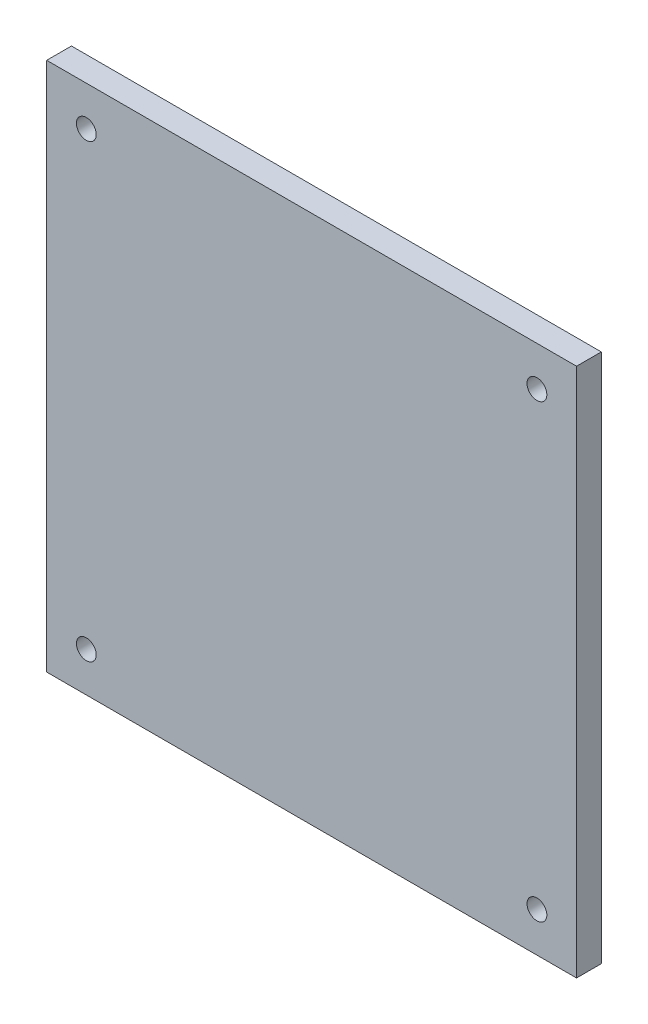
from build123d import *

# Parameters (mm, degrees)
SKETCH1_W           = 107
SKETCH1_H           = 107
BOSS_EXTRUDE1_DEPTH = 5
SKETCH2_R           = 2
CUT_EXTRUDE1_DEPTH  = 5


with BuildPart() as part:
    # Sketch1 → Boss-Extrude1 (new body)
    with BuildSketch(Plane.XY):
        Rectangle(SKETCH1_W, SKETCH1_H)
    extrude(amount=BOSS_EXTRUDE1_DEPTH)

    # Sketch2 → Cut-Extrude1 (cut)
    with BuildSketch(Plane.XY.offset(5)):
        with Locations((-45.5, 45.5)):
            Circle(SKETCH2_R)
        with Locations(Location((-45.5, -45.5, 0), (0, 0, 180))):
            Circle(SKETCH2_R)
        with Locations((45.5, -45.5)):
            Circle(SKETCH2_R)
        with Locations(Location((45.5, 45.5, 0), (0, 0, 180))):
            Circle(SKETCH2_R)
    extrude(amount=-CUT_EXTRUDE1_DEPTH, mode=Mode.SUBTRACT)


solid = part.part
